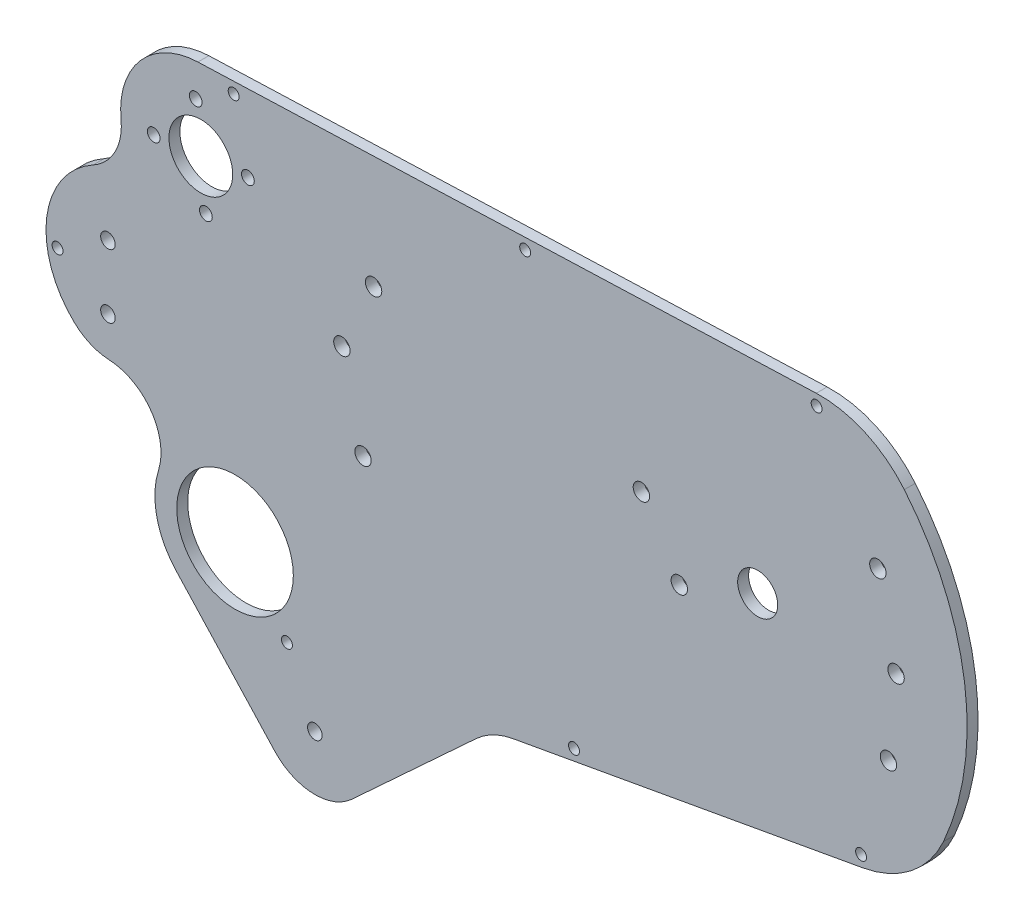
from build123d import *

# Parameters (mm, degrees)
SKETCH1_R           = 2
SKETCH1_R_2         = 16
SKETCH1_R_3         = 2.25
SKETCH1_R_4         = 5.5
SKETCH1_R_5         = 1.75
SKETCH1_R_6         = 8.75
BOSS_EXTRUDE1_DEPTH = 3
SKETCH2_R           = 1.5
CUT_EXTRUDE1_DEPTH  = 190.515777006


with BuildPart() as part:
    # Sketch1 → Boss-Extrude1 (new body)
    with BuildSketch(Plane.XY):
        with BuildLine():
            ThreePointArc((-137.970351553, -33.480224156), (-126.431132561, -39.888203569), (-124.422839539, -52.93360637))
            ThreePointArc((-124.422839539, -52.93360637), (-124.888175134, -64.31939994), (-119.594822483, -74.410646153))
            Line((-119.594822483, -74.410646153), (-92.540517723, -103.740413224))
            ThreePointArc((-92.540517723, -103.740413224), (-82.119700521, -108.557935129), (-71.344567605, -104.595807028))
            Line((-71.344567605, -104.595807028), (-37.221129556, -73.119733925))
            ThreePointArc((-37.221129556, -73.119733925), (-32.538343047, -69.892896145), (-27.140055215, -68.104192696))
            Line((-27.140055215, -68.104192696), (68.925058584, -50.795851294))
            ThreePointArc((68.925058584, -50.795851294), (82.107908339, -44.886103489), (91, -33.5))
            ThreePointArc((91, -33.5), (96.805715124, 7.17766304), (80.26119478, 44.789595257))
            ThreePointArc((80.26119478, 44.789595257), (69.434281248, 53.01522195), (56.08825014, 55.616461034))
            Line((56.08825014, 55.616461034), (-113.612396892, 49.485657177))
            ThreePointArc((-113.612396892, 49.485657177), (-129.404309407, 41.953313258), (-134.705774542, 25.279526249))
            ThreePointArc((-134.705774542, 25.279526249), (-136.343375771, 16.802270376), (-142.382746132, 10.632050724))
            ThreePointArc((-142.382746132, 10.632050724), (-155.099864059, -8.058287742), (-147.542861296, -29.364285714))
            ThreePointArc((-147.542861296, -29.364285714), (-143.125485566, -32.280163581), (-137.970351553, -33.480224156))
        make_face()
        with Locations((-81.514845762, -93.570135067)):
            Circle(SKETCH1_R, mode=Mode.SUBTRACT)
        with Locations((-103.42383694, -59.494238188)):
            Circle(SKETCH1_R_2, mode=Mode.SUBTRACT)
        with Locations((-138.3, -22.75)):
            Circle(SKETCH1_R, mode=Mode.SUBTRACT)
        with Locations((-138.3, -5.25)):
            Circle(SKETCH1_R, mode=Mode.SUBTRACT)
        with Locations((-68.3, -21.5)):
            Circle(SKETCH1_R_3, mode=Mode.SUBTRACT)
        with Locations((-74.1, 1.7)):
            Circle(SKETCH1_R_3, mode=Mode.SUBTRACT)
        with Locations((-65.4, 20.2)):
            Circle(SKETCH1_R_3, mode=Mode.SUBTRACT)
        with Locations((18.5, -8.7)):
            Circle(SKETCH1_R_3, mode=Mode.SUBTRACT)
        with Locations((8.1, 8.2)):
            Circle(SKETCH1_R_3, mode=Mode.SUBTRACT)
        with Locations((75.9, -21.8)):
            Circle(SKETCH1_R_3, mode=Mode.SUBTRACT)
        with Locations((40.017782272, 0)):
            Circle(SKETCH1_R_4, mode=Mode.SUBTRACT)
        with Locations((78, -0.1)):
            Circle(SKETCH1_R_3, mode=Mode.SUBTRACT)
        with Locations((73, 22.4)):
            Circle(SKETCH1_R_3, mode=Mode.SUBTRACT)
        with Locations((-114.213840088, 40.424858245)):
            Circle(SKETCH1_R_5, mode=Mode.SUBTRACT)
        with Locations((-111.422396488, 14.575141755)):
            Circle(SKETCH1_R_5, mode=Mode.SUBTRACT)
        with Locations((-125.742976533, 26.1042782)):
            Circle(SKETCH1_R_5, mode=Mode.SUBTRACT)
        with Locations((-112.818118288, 27.5)):
            Circle(SKETCH1_R_6, mode=Mode.SUBTRACT)
        with Locations((-99.893260043, 28.8957218)):
            Circle(SKETCH1_R_5, mode=Mode.SUBTRACT)
    extrude(amount=BOSS_EXTRUDE1_DEPTH)

    # Sketch2 → Cut-Extrude1 (cut, through all)
    with BuildSketch(Plane.XY.offset(3)):
        with Locations((56.196560986, 52.618416878)):
            Circle(SKETCH2_R)
        with Locations((-23.803439014, 49.728243404)):
            Circle(SKETCH2_R)
        with Locations((-103.803439014, 46.83806993)):
            Circle(SKETCH2_R)
        with Locations((68.393104802, -47.843390427)):
            Circle(SKETCH2_R)
        with Locations((-10.390547842, -62.038078831)):
            Circle(SKETCH2_R)
        with Locations((-152.133709173, -14)):
            Circle(SKETCH2_R)
        with Locations((-89.174200485, -76.232767235)):
            Circle(SKETCH2_R)
    extrude(amount=-CUT_EXTRUDE1_DEPTH, mode=Mode.SUBTRACT)


solid = part.part
